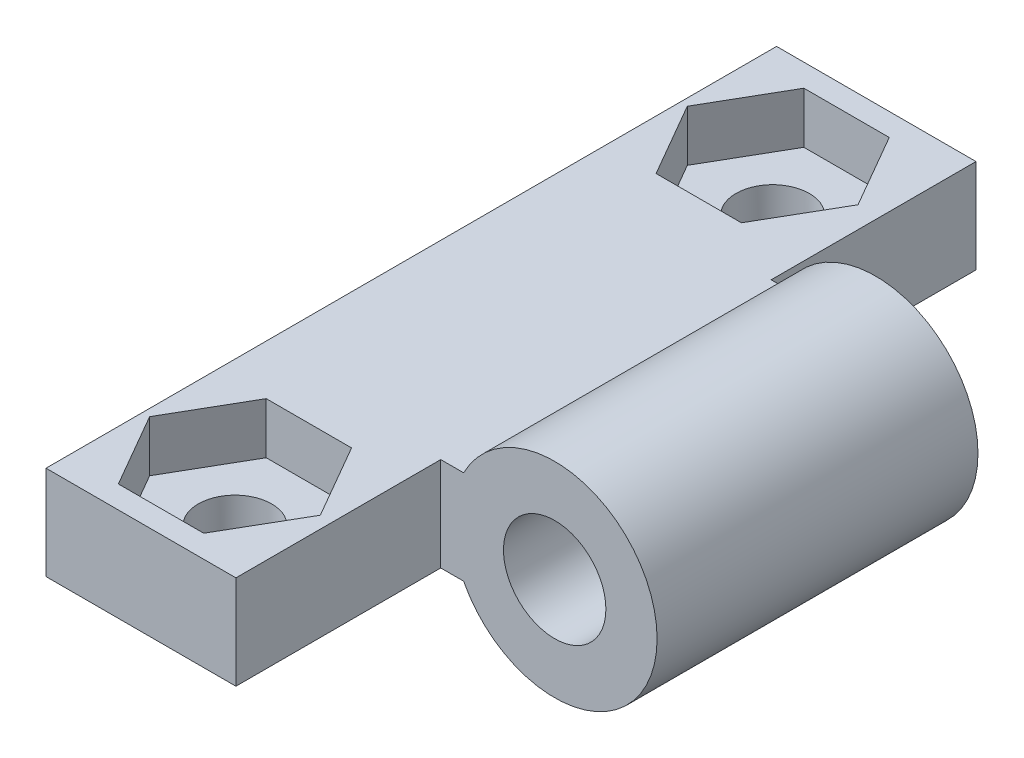
from build123d import *

# Parameters (mm, degrees)
SKETCH_1_W          = 17.8
SKETCH_1_H          = 42.8
EXTRUDE_1_DEPTH     = 5.5
SKETCH_6_R          = 2.15
CUT_EXTRUDE_3_DEPTH = 10
CUT_EXTRUDE_4_DEPTH = 3
SKETCH_10_R         = 6
EXTRUDE_5_DEPTH     = 18.8
SKETCH_12_W         = 9.298485121
SKETCH_12_H         = 14.239097106
CUT_EXTRUDE_5_DEPTH = 12
SKETCH_13_W         = 8.310362724
SKETCH_13_H         = 15.683275995
CUT_EXTRUDE_6_DEPTH = 12
SKETCH_14_R         = 3
CUT_EXTRUDE_7_DEPTH = 22


with BuildPart() as part:
    # 草图1 → 凸台-拉伸1 (new body)
    with BuildSketch(Plane(origin=(0, 0, 0), x_dir=(1, 0, 0), z_dir=(0, 1, 0))):
        with Locations((8.9, -21.4)):
            Rectangle(SKETCH_1_W, SKETCH_1_H)
    extrude(amount=EXTRUDE_1_DEPTH)

    # 草图6 → 切除-拉伸3 (cut)
    with BuildSketch(Plane(origin=(0, 5.5, 0), x_dir=(1, 0, 0), z_dir=(0, 1, 0))):
        with Locations(Location((5.420411498, -5.65, 0), (0, 0, 270))):
            Circle(SKETCH_6_R)
        with Locations(Location((5.420411498, -37.15, 0), (0, 0, 270))):
            Circle(SKETCH_6_R)
    extrude(amount=-CUT_EXTRUDE_3_DEPTH, mode=Mode.SUBTRACT)

    # 草图7 → 切除-拉伸4 (cut)
    with BuildSketch(Plane(origin=(0, 5.5, 0), x_dir=(1, 0, 0), z_dir=(0, 1, 0))):
        Polygon((2.920411498, -1.319872981), (7.920411498, -1.319872981), (10.420411498, -5.65), (7.920411498, -9.980127019), (2.920411498, -9.980127019), (0.420411498, -5.65), align=None)
        Polygon((0.420411498, -37.15), (2.920411498, -32.819872981), (7.920411498, -32.819872981), (10.420411498, -37.15), (7.920411498, -41.480127019), (2.920411498, -41.480127019), align=None)
    extrude(amount=-CUT_EXTRUDE_4_DEPTH, mode=Mode.SUBTRACT)

    # 草图10 → 凸台-拉伸5 (add)
    with BuildSketch(Plane.XY.offset(30.8)):
        with Locations((17.8, 2.75)):
            Circle(SKETCH_10_R)
    extrude(amount=-EXTRUDE_5_DEPTH)

    # 草图12 → 切除-拉伸5 (cut)
    with BuildSketch(Plane.XY.offset(42.8)):
        with Locations((15.774868429, 2.737331764)):
            Rectangle(SKETCH_12_W, SKETCH_12_H)
    extrude(amount=-CUT_EXTRUDE_5_DEPTH, mode=Mode.SUBTRACT)

    # 草图13 → 切除-拉伸6 (cut)
    with BuildSketch(Plane(origin=(0, 0, 0), x_dir=(-1, 0, 0), z_dir=(0, 0, -1))):
        with Locations((-15.838209607, 3.510094151)):
            Rectangle(SKETCH_13_W, SKETCH_13_H)
    extrude(amount=-CUT_EXTRUDE_6_DEPTH, mode=Mode.SUBTRACT)

    # 草图14 → 切除-拉伸7 (cut)
    with BuildSketch(Plane.XY.offset(30.8)):
        with Locations((17.8, 2.75)):
            Circle(SKETCH_14_R)
    extrude(amount=-CUT_EXTRUDE_7_DEPTH, mode=Mode.SUBTRACT)


solid = part.part
